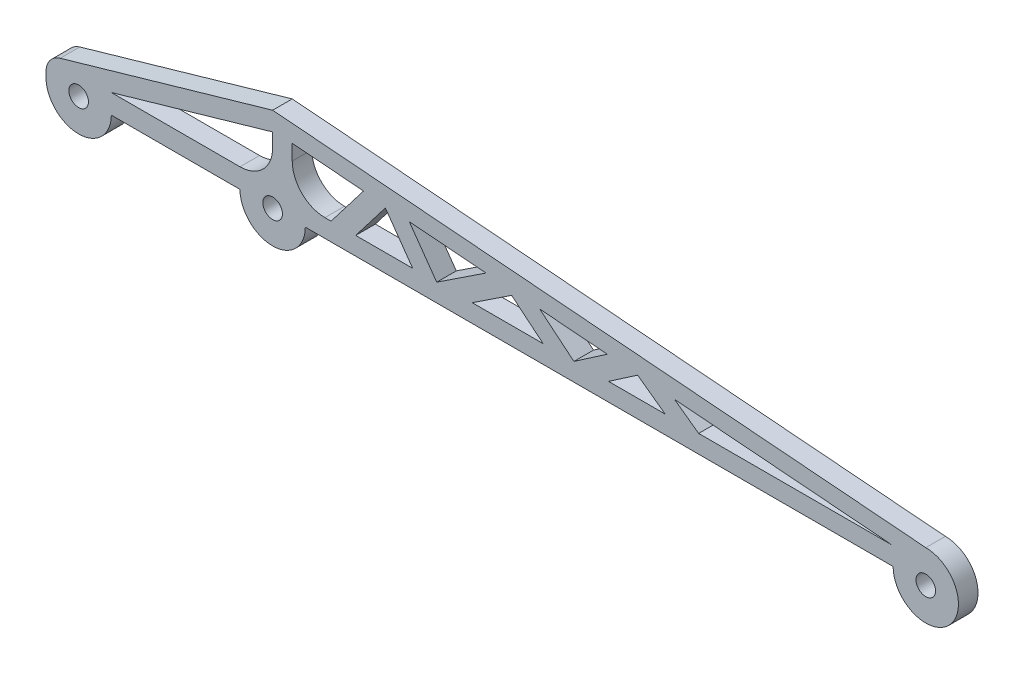
from build123d import *

# Parameters (mm, degrees)
SKETCH1_R           = 1.5
BOSS_EXTRUDE1_DEPTH = 3
FILLET1_R           = 3
FILLET2_R           = 5
FILLET3_R           = 5


with BuildPart() as part:
    # Sketch1 → Boss-Extrude1 (new body)
    with BuildSketch(Plane.XY):
        with BuildLine():
            Line((-34.7, 0), (-34.7, 3))
            Line((-34.7, 3), (0, 13))
            Line((0, 13), (100, 5))
            ThreePointArc((100, 5), (103.535533906, -3.535533906), (95, 0))
            Line((95, 0), (5, 0))
            ThreePointArc((5, 0), (0, -5), (-5, 0))
            Line((-5, 0), (-24.7, 0))
            ThreePointArc((-24.7, 0), (-29.7, -5), (-34.7, 0))
        make_face()
        with Locations((-29.7, 0)):
            Circle(SKETCH1_R, mode=Mode.SUBTRACT)
        Circle(SKETCH1_R, mode=Mode.SUBTRACT)
        with Locations((100, 0)):
            Circle(SKETCH1_R, mode=Mode.SUBTRACT)
        Polygon((-24.7, 3), (0, 10.11815562), (0, 3), align=None, mode=Mode.SUBTRACT)
        Polygon((3, 10.11815562), (3, 2.75815562), (8.936211527, 2.75815562), (13.917047711, 9.244791803), align=None, mode=Mode.SUBTRACT)
        Polygon((95, 2.75815562), (61.51973762, 5.43657661), (65.22442054, 2.75815562), align=None, mode=Mode.SUBTRACT)
        Polygon((12.718604589, 2.75815562), (17.259569147, 8.671938752), (21.444976035, 2.75815562), align=None, mode=Mode.SUBTRACT)
        Polygon((20.926325466, 8.684049582), (25.120303644, 2.75815562), (32.666592003, 7.744828259), align=None, mode=Mode.SUBTRACT)
        Polygon((30.561852618, 2.75815562), (41.416029489, 2.75815562), (36.591409828, 6.742555173), align=None, mode=Mode.SUBTRACT)
        Polygon((40.885181342, 7.087341112), (46.12729453, 2.75815562), (51.230503333, 6.259715353), align=None, mode=Mode.SUBTRACT)
        Polygon((51.429784502, 2.75815562), (60.104052681, 2.75815562), (55.880288815, 5.81186306), align=None, mode=Mode.SUBTRACT)
    extrude(amount=BOSS_EXTRUDE1_DEPTH)

    # Fillet1
    fillet1_edges = [part.edges().sort_by_distance(p)[0] for p in [
        (-34.7, 3, 1.5),
    ]]
    fillet(fillet1_edges, radius=FILLET1_R)

    # Fillet2
    fillet2_edges = [part.edges().sort_by_distance(p)[0] for p in [
        (0, 3, 1.5),
    ]]
    fillet(fillet2_edges, radius=FILLET2_R)

    # Fillet3
    fillet3_edges = [part.edges().sort_by_distance(p)[0] for p in [
        (3, 2.75815562, 1.5),
    ]]
    fillet(fillet3_edges, radius=FILLET3_R)


solid = part.part
